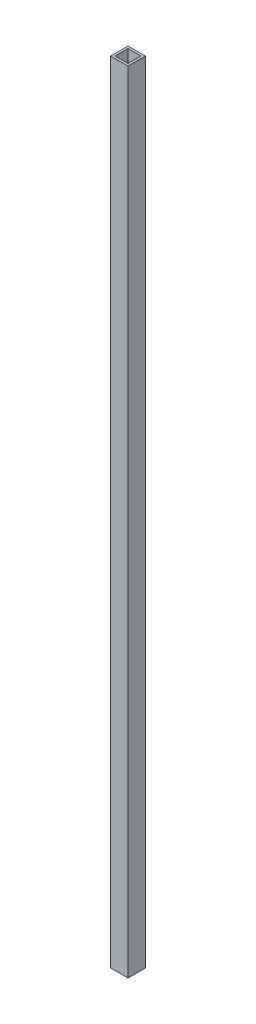
from build123d import *

# Parameters (mm, degrees)
SCHIZZO1_W                   = 40
SCHIZZO1_H                   = 40
SCHIZZO1_W_2                 = 30
SCHIZZO1_H_2                 = 30
ESTRUSIONE_ESTRUSIONE1_DEPTH = 1820


with BuildPart() as part:
    # Schizzo1 → Estrusione-Estrusione1 (new body)
    with BuildSketch(Plane(origin=(0, 0, 0), x_dir=(1, 0, 0), z_dir=(0, 1, 0))):
        Rectangle(SCHIZZO1_W, SCHIZZO1_H)
        Rectangle(SCHIZZO1_W_2, SCHIZZO1_H_2, mode=Mode.SUBTRACT)
    extrude(amount=ESTRUSIONE_ESTRUSIONE1_DEPTH)


solid = part.part
